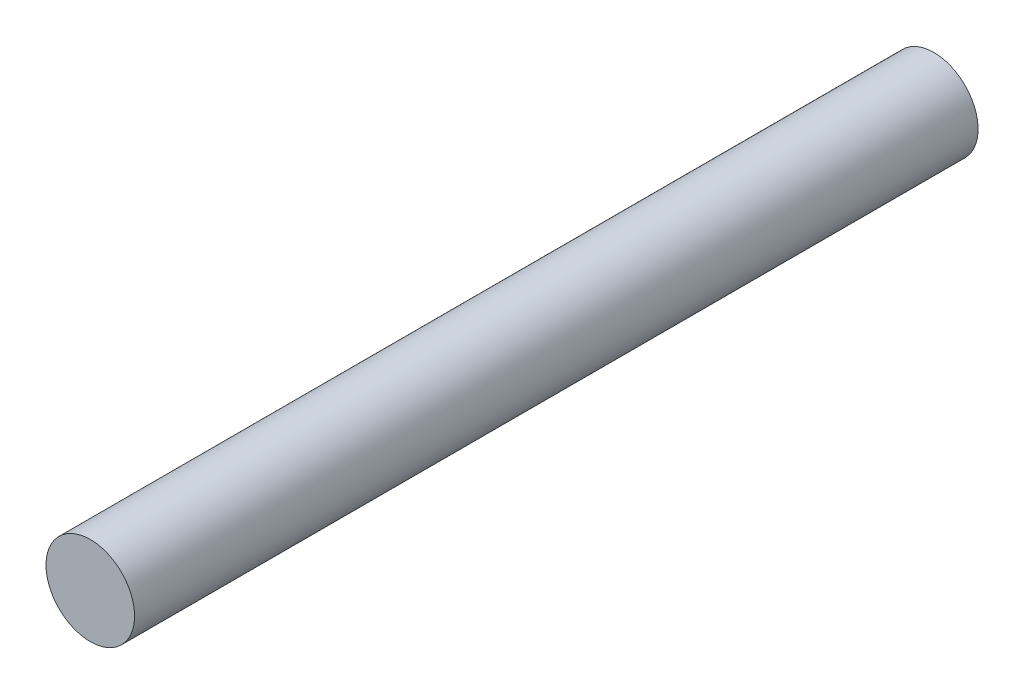
from build123d import *

# Parameters (mm, degrees)
SKETCH1_R           = 4
BOSS_EXTRUDE1_DEPTH = 76.2


with BuildPart() as part:
    # Sketch1 → Boss-Extrude1 (new body)
    with BuildSketch(Plane.XY):
        with Locations(Location((0, 0, 0), (0, 0, 180))):
            Circle(SKETCH1_R)
    extrude(amount=BOSS_EXTRUDE1_DEPTH)


solid = part.part
